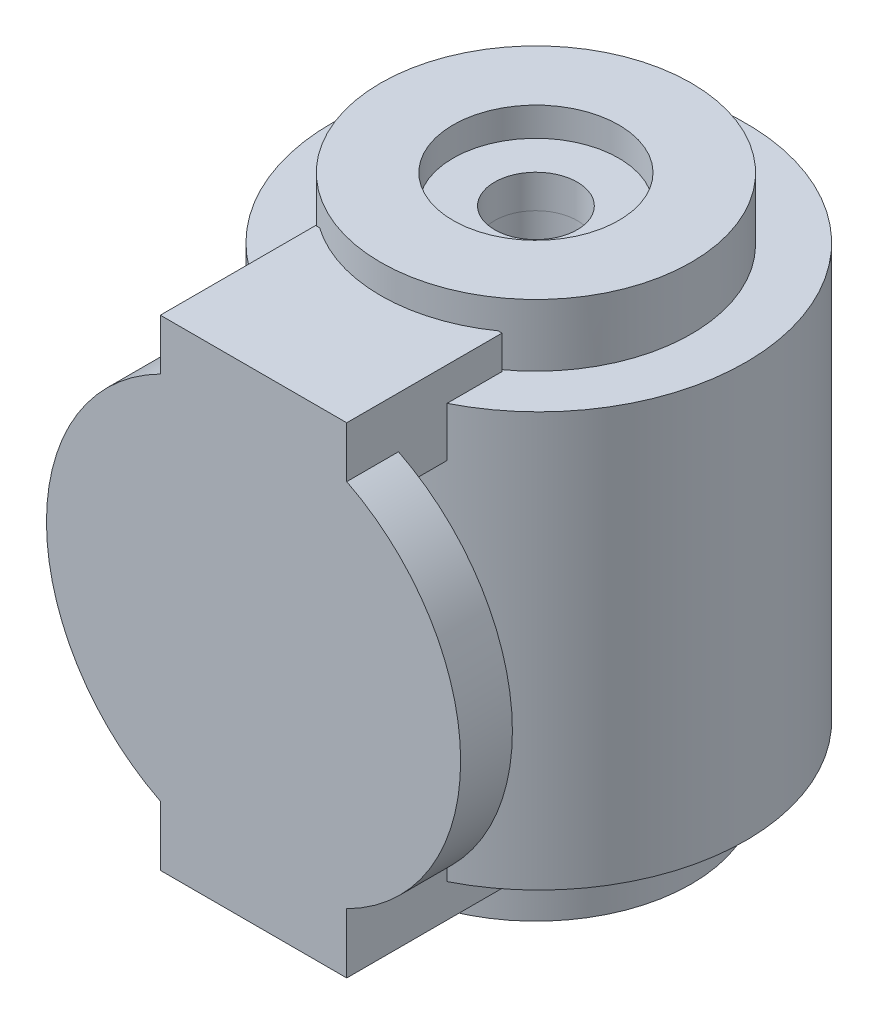
from build123d import *

# Parameters (mm, degrees)
SKETCH_1_R           = 20
EXTRUDE_1_DEPTH      = 5
SKETCH_3_W           = 18
SKETCH_3_H           = 8
EXTRUDE_2_DEPTH      = 15
EXTRUDE_3_DEPTH      = 35.22
EXTRUDE_3_DEPTH_BACK = 4.78
SKETCH_4_R           = 20
EXTRUDE_4_DEPTH      = 6
EXTRUDE_4_DEPTH_BACK = 36.43845651
SKETCH_6_R           = 15
SKETCH_10_R          = 8
CUT_EXTRUDE_1_DEPTH  = 6
EXTRUDE_START        = 6
SKETCH_14_R          = 15
EXTRUDE_6_DEPTH      = 6
CUT_EXTRUDE_START    = 6
SKETCH_11_R          = 8
CUT_EXTRUDE_4_DEPTH  = 6
SKETCH_16_R          = 4
CUT_EXTRUDE_5_DEPTH  = 50
SKETCH_23_R          = 4.01
SKETCH_23_R_2        = 3.99
EXTRUDE_7_DEPTH      = 3.22


with BuildPart() as part:
    # 草图1 → 凸台-拉伸1 (new body)
    with BuildSketch(Plane.XY):
        Circle(SKETCH_1_R)
    extrude(amount=EXTRUDE_1_DEPTH)

    # 草图3 → 凸台-拉伸2 (add)
    with BuildSketch(Plane.XY.offset(5)):
        with Locations((0, -19.652481849)):
            Rectangle(SKETCH_3_W, SKETCH_3_H)
        with Locations((0, 18.785974665)):
            Rectangle(SKETCH_3_W, SKETCH_3_H)
    extrude(amount=-EXTRUDE_2_DEPTH)

    # 草图4 → 凸台-拉伸3 (add, two sides: drawn at the far end of the back side and taken through both)
    with BuildSketch(Plane.XZ.offset(-14.785974665).offset(-EXTRUDE_3_DEPTH_BACK)):
        with Locations((0, -22.547246605)):
            Circle(SKETCH_4_R)
    extrude(amount=EXTRUDE_3_DEPTH + EXTRUDE_3_DEPTH_BACK)

    # 草图6 → 凸台-拉伸4 (add, two sides: drawn at the far end of the back side and taken through both)
    with BuildSketch(Plane(origin=(0, 19.565974665, 0), x_dir=(1, 0, 0), z_dir=(0, 1, 0)).offset(-EXTRUDE_4_DEPTH_BACK)):
        with Locations((0, 22.272123062)):
            Circle(SKETCH_6_R)
    extrude(amount=EXTRUDE_4_DEPTH + EXTRUDE_4_DEPTH_BACK)

    # 草图10 → 切除-拉伸1 (cut)
    with BuildSketch(Plane(origin=(0, 22.785974665, 0), x_dir=(1, 0, 0), z_dir=(0, 1, 0))):
        with Locations((0, 22.272123062)):
            Circle(SKETCH_10_R)
    extrude(amount=CUT_EXTRUDE_1_DEPTH, mode=Mode.SUBTRACT)

    # 草图14 → 凸台-拉伸6 (add)
    with BuildSketch(Plane(origin=(0, -20.434025335, 0), x_dir=(-1, 0, 0), z_dir=(0, -1, 0)).offset(EXTRUDE_START)):
        with Locations((0, 22.272123062)):
            Circle(SKETCH_14_R)
    extrude(amount=-EXTRUDE_6_DEPTH)

    # 草图11 → 切除-拉伸4 (cut)
    with BuildSketch(Plane.XZ.offset(23.652481849).offset(CUT_EXTRUDE_START)):
        with Locations((0, -22.272123062)):
            Circle(SKETCH_11_R)
    extrude(amount=-CUT_EXTRUDE_4_DEPTH, mode=Mode.SUBTRACT)

    # 草图16 → 切除-拉伸5 (cut)
    with BuildSketch(Plane(origin=(0, 22.785974665, 0), x_dir=(1, 0, 0), z_dir=(0, 1, 0))):
        with Locations((0, 22.272123062)):
            Circle(SKETCH_16_R)
    extrude(amount=-CUT_EXTRUDE_5_DEPTH, mode=Mode.SUBTRACT)

    # 草图23 → 凸台-拉伸7 (add)
    with BuildSketch(Plane(origin=(0, 22.785974665, 0), x_dir=(1, 0, 0), z_dir=(0, 1, 0))):
        with Locations((0, 22.272123062)):
            Circle(SKETCH_23_R)
        with Locations((0, 22.272123062)):
            Circle(SKETCH_23_R_2, mode=Mode.SUBTRACT)
    extrude(amount=-EXTRUDE_7_DEPTH)


solid = part.part
